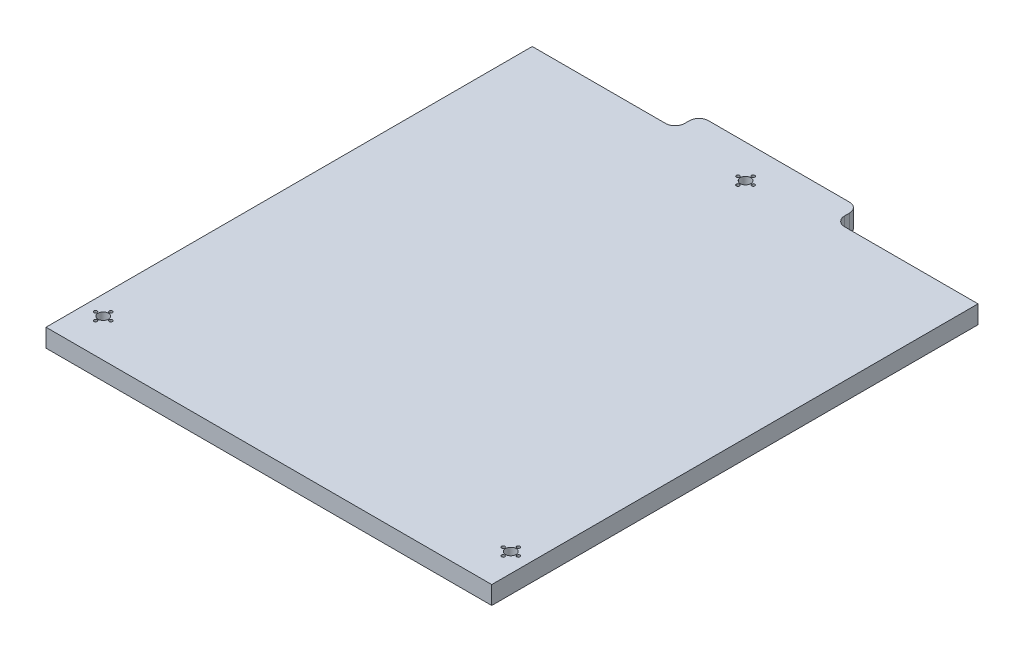
from build123d import *

# Parameters (mm, degrees)
SKETCH2_R            = 5.5
BOSS_EXTRUDE1_DEPTH  = 19.05
M3_CLEARANCE_HOLE1_D = 3.4
CIRPATTERN1_COUNT    = 4
FILLET1_R            = 10
M3_CLEARANCE_HOLE2_D = 3.4
CIRPATTERN2_COUNT    = 4
M3_CLEARANCE_HOLE3_D = 3.4
CIRPATTERN3_COUNT    = 4


with BuildPart() as part:
    # Sketch2 → Boss-Extrude1 (new body)
    with BuildSketch(Plane(origin=(0, 0, 0), x_dir=(1, 0, 0), z_dir=(0, 1, 0))):
        Polygon((0, 0), (467.5, 0), (467.5, 510), (317.652811453, 510), (317.652811453, 535), (149.847188547, 535), (149.847188547, 510), (0, 510), align=None)
        with Locations(Location((233.75, 500, 0), (0, 0, 90))):
            Circle(SKETCH2_R, mode=Mode.SUBTRACT)
        with Locations(Location((20, 40, 0), (0, 0, 90))):
            Circle(SKETCH2_R, mode=Mode.SUBTRACT)
        with Locations(Location((447.5, 40, 0), (0, 0, 90))):
            Circle(SKETCH2_R, mode=Mode.SUBTRACT)
    extrude(amount=BOSS_EXTRUDE1_DEPTH)

    # M3 Clearance Hole1 (through all)
    with Locations(Plane(origin=(225.75, 19.05, -500), x_dir=(0, 0, 1), z_dir=(0, 1, 0))):
        with Locations((0, 0)):
            m3_clearance_hole1 = Hole(M3_CLEARANCE_HOLE1_D / 2)

    # CirPattern1: M3 Clearance Hole1 ×4 about axis
    cirpattern1_axis = Axis((233.75, 0, -500), (0, 1, 0))
    for i in range(1, CIRPATTERN1_COUNT):
        add(m3_clearance_hole1.rotate(cirpattern1_axis, i * 360 / CIRPATTERN1_COUNT), mode=Mode.SUBTRACT)

    # Fillet1
    fillet1_edges = [part.edges().sort_by_distance(p)[0] for p in [
        (149.847188547, 9.525, -510),
        (149.847188547, 9.525, -535),
        (317.652811453, 9.525, -535),
        (317.652811453, 9.525, -510),
    ]]
    fillet(fillet1_edges, radius=FILLET1_R)

    # M3 Clearance Hole2 (through all)
    with Locations(Plane(origin=(20, 19.05, -48), x_dir=(0, 0, 1), z_dir=(0, 1, 0))):
        with Locations((0, 0)):
            m3_clearance_hole2 = Hole(M3_CLEARANCE_HOLE2_D / 2)

    # CirPattern2: M3 Clearance Hole2 ×4 about axis
    cirpattern2_axis = Axis((20, 0, -40), (0, 1, 0))
    for i in range(1, CIRPATTERN2_COUNT):
        add(m3_clearance_hole2.rotate(cirpattern2_axis, i * 360 / CIRPATTERN2_COUNT), mode=Mode.SUBTRACT)

    # M3 Clearance Hole3 (through all)
    with Locations(Plane(origin=(447.5, 19.05, -48), x_dir=(0, 0, 1), z_dir=(0, 1, 0))):
        with Locations((0, 0)):
            m3_clearance_hole3 = Hole(M3_CLEARANCE_HOLE3_D / 2)

    # CirPattern3: M3 Clearance Hole3 ×4 about axis
    cirpattern3_axis = Axis((447.5, 0, -40), (0, 1, 0))
    for i in range(1, CIRPATTERN3_COUNT):
        add(m3_clearance_hole3.rotate(cirpattern3_axis, i * 360 / CIRPATTERN3_COUNT), mode=Mode.SUBTRACT)


solid = part.part
